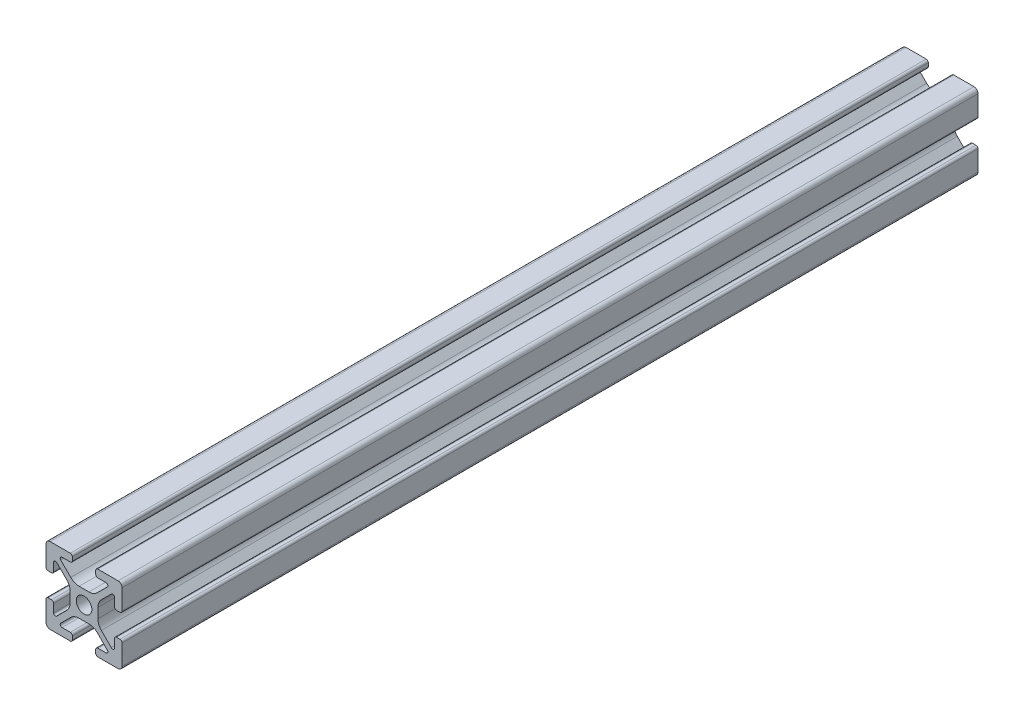
from build123d import *

# Parameters (mm, degrees)
SKETCH1_R           = 2.05
BOSS_EXTRUDE1_DEPTH = 225


with BuildPart() as part:
    # Sketch1 → Boss-Extrude1 (new body)
    with BuildSketch(Plane.XY):
        with BuildLine():
            Line((-3.642230561, 1.287773026), (-3.642230561, -1.287773026))
            ThreePointArc((-3.642230561, -1.287773026), (-3.87999308, -2.483085929), (-4.55708345, -3.496423279))
            Line((-4.55708345, -3.496423279), (-7.182004606, -6.121344434))
            ThreePointArc((-7.182004606, -6.121344434), (-7.704200045, -6.225215565), (-8, -5.782519648))
            Line((-8, -5.782519648), (-8, -3.622007668))
            ThreePointArc((-8, -3.622007668), (-8.161974206, -3.230967343), (-8.553014531, -3.068993137))
            Line((-8.553014531, -3.068993137), (-9.443284204, -3.068993137))
            ThreePointArc((-9.443284204, -3.068993137), (-9.836715763, -3.229656566), (-10, -3.622007668))
            Line((-10, -3.622007668), (-10, -8.939033256))
            ThreePointArc((-10, -8.939033256), (-9.689250035, -9.689250035), (-8.939033256, -10))
            Line((-8.939033256, -10), (-3.622007668, -10))
            ThreePointArc((-3.622007668, -10), (-3.229656566, -9.836715763), (-3.068993137, -9.443284204))
            Line((-3.068993137, -9.443284204), (-3.068993137, -8.553014531))
            ThreePointArc((-3.068993137, -8.553014531), (-3.230967343, -8.161974206), (-3.622007668, -8))
            Line((-3.622007668, -8), (-5.782519648, -8))
            ThreePointArc((-5.782519648, -8), (-6.225215565, -7.704200045), (-6.121344434, -7.182004606))
            Line((-6.121344434, -7.182004606), (-3.496423279, -4.55708345))
            ThreePointArc((-3.496423279, -4.55708345), (-2.483085929, -3.87999308), (-1.287773026, -3.642230561))
            Line((-1.287773026, -3.642230561), (1.287773026, -3.642230561))
            ThreePointArc((1.287773026, -3.642230561), (2.483085929, -3.87999308), (3.496423279, -4.55708345))
            Line((3.496423279, -4.55708345), (6.121344434, -7.182004606))
            ThreePointArc((6.121344434, -7.182004606), (6.225215565, -7.704200045), (5.782519648, -8))
            Line((5.782519648, -8), (3.622007668, -8))
            ThreePointArc((3.622007668, -8), (3.230967343, -8.161974206), (3.068993137, -8.553014531))
            Line((3.068993137, -8.553014531), (3.068993137, -9.443284204))
            ThreePointArc((3.068993137, -9.443284204), (3.229656566, -9.836715763), (3.622007668, -10))
            Line((3.622007668, -10), (8.939033256, -10))
            ThreePointArc((8.939033256, -10), (9.689250035, -9.689250035), (10, -8.939033256))
            Line((10, -8.939033256), (10, -3.622007668))
            ThreePointArc((10, -3.622007668), (9.836715763, -3.229656566), (9.443284204, -3.068993137))
            Line((9.443284204, -3.068993137), (8.553014531, -3.068993137))
            ThreePointArc((8.553014531, -3.068993137), (8.161974206, -3.230967343), (8, -3.622007668))
            Line((8, -3.622007668), (8, -5.782519648))
            ThreePointArc((8, -5.782519648), (7.704200045, -6.225215565), (7.182004606, -6.121344434))
            Line((7.182004606, -6.121344434), (4.55708345, -3.496423279))
            ThreePointArc((4.55708345, -3.496423279), (3.87999308, -2.483085929), (3.642230561, -1.287773026))
            Line((3.642230561, -1.287773026), (3.642230561, 1.287773026))
            ThreePointArc((3.642230561, 1.287773026), (3.87999308, 2.483085929), (4.55708345, 3.496423279))
            Line((4.55708345, 3.496423279), (7.182004606, 6.121344434))
            ThreePointArc((7.182004606, 6.121344434), (7.704200045, 6.225215565), (8, 5.782519648))
            Line((8, 5.782519648), (8, 3.622007668))
            ThreePointArc((8, 3.622007668), (8.161974206, 3.230967343), (8.553014531, 3.068993137))
            Line((8.553014531, 3.068993137), (9.443284204, 3.068993137))
            ThreePointArc((9.443284204, 3.068993137), (9.836715763, 3.229656566), (10, 3.622007668))
            Line((10, 3.622007668), (10, 8.939033256))
            ThreePointArc((10, 8.939033256), (9.689250035, 9.689250035), (8.939033256, 10))
            Line((8.939033256, 10), (3.622007668, 10))
            ThreePointArc((3.622007668, 10), (3.229656566, 9.836715763), (3.068993137, 9.443284204))
            Line((3.068993137, 9.443284204), (3.068993137, 8.553014531))
            ThreePointArc((3.068993137, 8.553014531), (3.230967343, 8.161974206), (3.622007668, 8))
            Line((3.622007668, 8), (5.782519648, 8))
            ThreePointArc((5.782519648, 8), (6.225215565, 7.704200045), (6.121344434, 7.182004606))
            Line((6.121344434, 7.182004606), (3.496423279, 4.55708345))
            ThreePointArc((3.496423279, 4.55708345), (2.483085929, 3.87999308), (1.287773026, 3.642230561))
            Line((1.287773026, 3.642230561), (-1.287773026, 3.642230561))
            ThreePointArc((-1.287773026, 3.642230561), (-2.483085929, 3.87999308), (-3.496423279, 4.55708345))
            Line((-3.496423279, 4.55708345), (-6.121344434, 7.182004606))
            ThreePointArc((-6.121344434, 7.182004606), (-6.225215565, 7.704200045), (-5.782519648, 8))
            Line((-5.782519648, 8), (-3.622007668, 8))
            ThreePointArc((-3.622007668, 8), (-3.230967343, 8.161974206), (-3.068993137, 8.553014531))
            Line((-3.068993137, 8.553014531), (-3.068993137, 9.443284204))
            ThreePointArc((-3.068993137, 9.443284204), (-3.229656566, 9.836715763), (-3.622007668, 10))
            Line((-3.622007668, 10), (-8.939033256, 10))
            ThreePointArc((-8.939033256, 10), (-9.689250035, 9.689250035), (-10, 8.939033256))
            Line((-10, 8.939033256), (-10, 3.622007668))
            ThreePointArc((-10, 3.622007668), (-9.836715763, 3.229656566), (-9.443284204, 3.068993137))
            Line((-9.443284204, 3.068993137), (-8.553014531, 3.068993137))
            ThreePointArc((-8.553014531, 3.068993137), (-8.161974206, 3.230967343), (-8, 3.622007668))
            Line((-8, 3.622007668), (-8, 5.782519648))
            ThreePointArc((-8, 5.782519648), (-7.704200045, 6.225215565), (-7.182004606, 6.121344434))
            Line((-7.182004606, 6.121344434), (-4.55708345, 3.496423279))
            ThreePointArc((-4.55708345, 3.496423279), (-3.87999308, 2.483085929), (-3.642230561, 1.287773026))
        make_face()
        Circle(SKETCH1_R, mode=Mode.SUBTRACT)
    extrude(amount=-BOSS_EXTRUDE1_DEPTH)


solid = part.part
